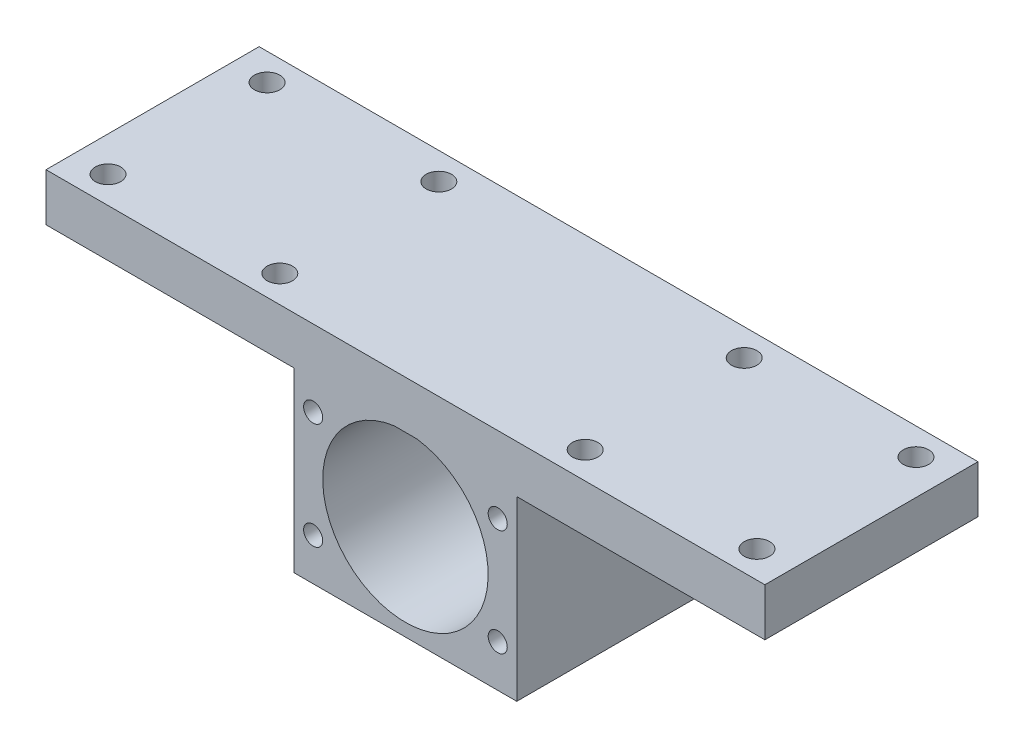
from build123d import *

# Parameters (mm, degrees)
SKETCH1_R           = 4
BOSS_EXTRUDE1_DEPTH = 15
SKETCH2_W           = 70
SKETCH2_H           = 60
SKETCH2_R           = 26
SKETCH2_R_2         = 3
BOSS_EXTRUDE3_DEPTH = 67


with BuildPart() as part:
    # Sketch1 → Boss-Extrude1 (new body)
    # profile 1 of 3: a face of its own
    with BuildSketch(Plane(origin=(0, 0, 0), x_dir=(1, 0, 0), z_dir=(0, 1, 0))):
        Polygon((37, 33.5), (-37, 33.5), (-113, 33.5), (-113, -33.5), (-37, -33.5), (37, -33.5), (113, -33.5), (113, 33.5), align=None)
        with Locations(Location((-102, -25, 0), (0, 0, 270))):
            Circle(SKETCH1_R, mode=Mode.SUBTRACT)
        with Locations(Location((-48, -25, 0), (0, 0, 270))):
            Circle(SKETCH1_R, mode=Mode.SUBTRACT)
        with Locations(Location((48, -25, 0), (0, 0, 270))):
            Circle(SKETCH1_R, mode=Mode.SUBTRACT)
        with Locations(Location((102, -25, 0), (0, 0, 270))):
            Circle(SKETCH1_R, mode=Mode.SUBTRACT)
        with Locations(Location((-102, 25, 0), (0, 0, 270))):
            Circle(SKETCH1_R, mode=Mode.SUBTRACT)
        with Locations(Location((-48, 25, 0), (0, 0, 270))):
            Circle(SKETCH1_R, mode=Mode.SUBTRACT)
        with Locations(Location((48, 25, 0), (0, 0, 270))):
            Circle(SKETCH1_R, mode=Mode.SUBTRACT)
        with Locations(Location((102, 25, 0), (0, 0, 270))):
            Circle(SKETCH1_R, mode=Mode.SUBTRACT)
    # profile 2 of 3: a face of its own
    with BuildSketch(Plane(origin=(0, 0, 0), x_dir=(1, 0, 0), z_dir=(0, 1, 0))):
        Polygon((37, 33.5), (-37, 33.5), (-113, 33.5), (-113, -33.5), (-37, -33.5), (37, -33.5), (113, -33.5), (113, 33.5), align=None)
        with Locations(Location((-102, -25, 0), (0, 0, 270))):
            Circle(SKETCH1_R, mode=Mode.SUBTRACT)
        with Locations(Location((-48, -25, 0), (0, 0, 270))):
            Circle(SKETCH1_R, mode=Mode.SUBTRACT)
        with Locations(Location((48, -25, 0), (0, 0, 270))):
            Circle(SKETCH1_R, mode=Mode.SUBTRACT)
        with Locations(Location((102, -25, 0), (0, 0, 270))):
            Circle(SKETCH1_R, mode=Mode.SUBTRACT)
        with Locations(Location((-102, 25, 0), (0, 0, 270))):
            Circle(SKETCH1_R, mode=Mode.SUBTRACT)
        with Locations(Location((-48, 25, 0), (0, 0, 270))):
            Circle(SKETCH1_R, mode=Mode.SUBTRACT)
        with Locations(Location((48, 25, 0), (0, 0, 270))):
            Circle(SKETCH1_R, mode=Mode.SUBTRACT)
        with Locations(Location((102, 25, 0), (0, 0, 270))):
            Circle(SKETCH1_R, mode=Mode.SUBTRACT)
    # profile 3 of 3: a face of its own
    with BuildSketch(Plane(origin=(0, 0, 0), x_dir=(1, 0, 0), z_dir=(0, 1, 0))):
        Polygon((37, 33.5), (-37, 33.5), (-113, 33.5), (-113, -33.5), (-37, -33.5), (37, -33.5), (113, -33.5), (113, 33.5), align=None)
        with Locations(Location((-102, -25, 0), (0, 0, 270))):
            Circle(SKETCH1_R, mode=Mode.SUBTRACT)
        with Locations(Location((-48, -25, 0), (0, 0, 270))):
            Circle(SKETCH1_R, mode=Mode.SUBTRACT)
        with Locations(Location((48, -25, 0), (0, 0, 270))):
            Circle(SKETCH1_R, mode=Mode.SUBTRACT)
        with Locations(Location((102, -25, 0), (0, 0, 270))):
            Circle(SKETCH1_R, mode=Mode.SUBTRACT)
        with Locations(Location((-102, 25, 0), (0, 0, 270))):
            Circle(SKETCH1_R, mode=Mode.SUBTRACT)
        with Locations(Location((-48, 25, 0), (0, 0, 270))):
            Circle(SKETCH1_R, mode=Mode.SUBTRACT)
        with Locations(Location((48, 25, 0), (0, 0, 270))):
            Circle(SKETCH1_R, mode=Mode.SUBTRACT)
        with Locations(Location((102, 25, 0), (0, 0, 270))):
            Circle(SKETCH1_R, mode=Mode.SUBTRACT)
    extrude(amount=BOSS_EXTRUDE1_DEPTH)

    # Sketch2 → Boss-Extrude3 (add)
    with BuildSketch(Plane.XY.offset(33.5)):
        with Locations((0, -25.75)):
            Rectangle(SKETCH2_W, SKETCH2_H)
        with Locations((0, -25.75)):
            Circle(SKETCH2_R, mode=Mode.SUBTRACT)
        with Locations((-29.011851027, -9)):
            Circle(SKETCH2_R_2, mode=Mode.SUBTRACT)
        with Locations((-29.011851027, -42.5)):
            Circle(SKETCH2_R_2, mode=Mode.SUBTRACT)
        with Locations((29.011851027, -42.5)):
            Circle(SKETCH2_R_2, mode=Mode.SUBTRACT)
        with Locations((29.011851027, -9)):
            Circle(SKETCH2_R_2, mode=Mode.SUBTRACT)
    extrude(amount=-BOSS_EXTRUDE3_DEPTH)


solid = part.part
